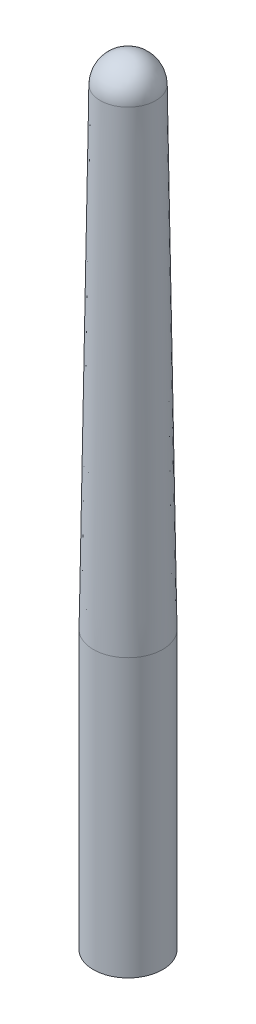
from build123d import *


with BuildPart() as part:
    # Sketch1 → Revolve1 (revolve)
    with BuildSketch(Plane.XY, mode=Mode.PRIVATE) as revolve1_sk:
        with BuildLine():
            Line((0, 0), (0, 112))
            ThreePointArc((0, 112), (-2.807564155, 110.849137329), (-3.999567918, 108.058791759))
            Line((-3.999567918, 108.058791759), (-5, 40))
            Line((-5, 40), (-5, 0))
            Line((-5, 0), (0, 0))
        make_face()
    revolve(revolve1_sk.sketch.rotate(Axis((0, 0, 0), (0, 1, 0)), 270), axis=Axis((0, 0, 0), (0, 1, 0)))


solid = part.part
